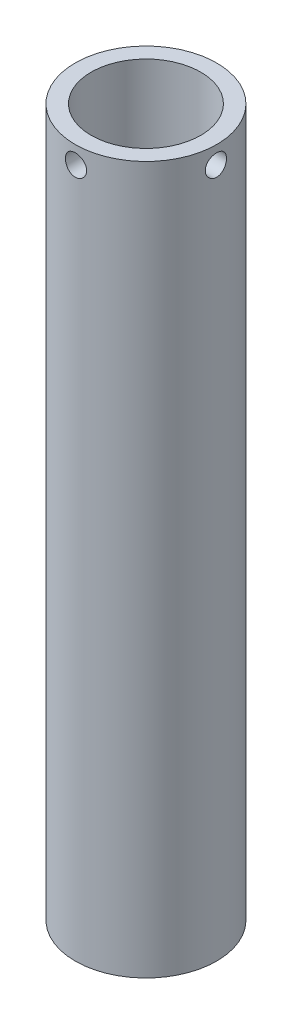
from build123d import *

# Parameters (mm, degrees)
SKETCH1_R                                = 2
SKETCH1_R_2                              = 1.55
BOSS_EXTRUDE1_DEPTH                      = 20
F_0_6_0_6_DIAMETER_HOLE1_REACH           = 22.006
F_0_6_0_6_DIAMETER_HOLE1_BORE_R          = 0.3
F_0_6_0_6_DIAMETER_HOLE1_ON_FACE_2_REACH = 22.006
F_0_6_0_6_DIAMETER_HOLE1_BORE_2_R        = 0.3


with BuildPart() as part:
    # Sketch1 → Boss-Extrude1 (new body)
    with BuildSketch(Plane(origin=(0, 0, 0), x_dir=(1, 0, 0), z_dir=(0, 1, 0))):
        with Locations(Location((0, 0, 0), (0, 0, 270))):
            Circle(SKETCH1_R)
        with Locations(Location((0, 0, 0), (0, 0, 270))):
            Circle(SKETCH1_R_2, mode=Mode.SUBTRACT)
    extrude(amount=BOSS_EXTRUDE1_DEPTH)

    # Ø0.6 (0.6) Diameter Hole1 bore (on position points) → Ø0.6 (0.6) Diameter Hole1 (cut, up to next)
    with BuildSketch(Plane(origin=(2, 19.5, 0), x_dir=(0, 0, 1), z_dir=(1, 0, 0)), mode=Mode.PRIVATE) as f_0_6_0_6_diameter_hole1_sk1:
        Circle(F_0_6_0_6_DIAMETER_HOLE1_BORE_R)
    f_0_6_0_6_diameter_hole1_tool1 = extrude(f_0_6_0_6_diameter_hole1_sk1.sketch, amount=-F_0_6_0_6_DIAMETER_HOLE1_REACH, mode=Mode.PRIVATE) & part.part
    add(f_0_6_0_6_diameter_hole1_tool1.solids().sort_by_distance((2, 19.5, 0))[0], mode=Mode.SUBTRACT)

    # Ø0.6 (0.6) Diameter Hole1 bore 2 (on position points) → Ø0.6 (0.6) Diameter Hole1 on face 2 (cut, up to next)
    with BuildSketch(Plane(origin=(0, 19.5, 2), x_dir=(1, 0, 0), z_dir=(0, 0, 1)), mode=Mode.PRIVATE) as f_0_6_0_6_diameter_hole1_on_face_2_sk1:
        Circle(F_0_6_0_6_DIAMETER_HOLE1_BORE_2_R)
    f_0_6_0_6_diameter_hole1_on_face_2_tool1 = extrude(f_0_6_0_6_diameter_hole1_on_face_2_sk1.sketch, amount=-F_0_6_0_6_DIAMETER_HOLE1_ON_FACE_2_REACH, mode=Mode.PRIVATE) & part.part
    add(f_0_6_0_6_diameter_hole1_on_face_2_tool1.solids().sort_by_distance((0, 19.5, 2))[0], mode=Mode.SUBTRACT)


solid = part.part
